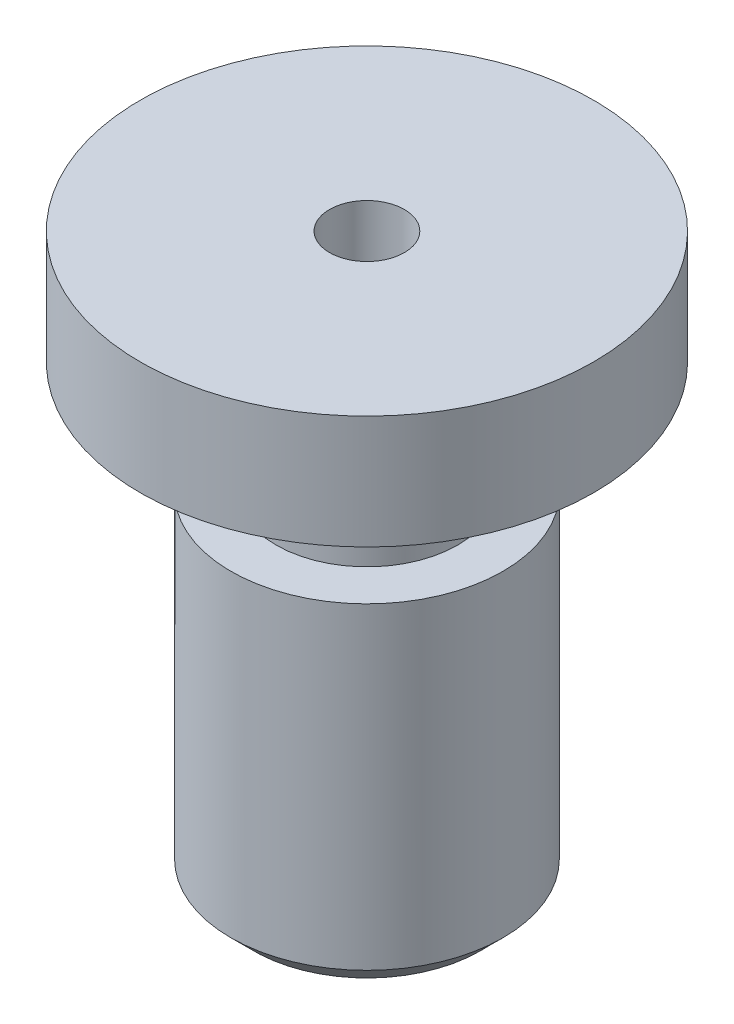
from build123d import *

# Parameters (mm, degrees)
CHAMFER_1_SIZE         = 1
HOLE_WIZARD_M4_1_D     = 3.3
HOLE_WIZARD_M4_1_DEPTH = 10
HOLE_WIZARD_M4_1_TIP   = 0.991420021


with BuildPart() as part:
    # 草图1 → 旋转1 (revolve)
    with BuildSketch(Plane.XY, mode=Mode.PRIVATE) as revolve_1_sk:
        Polygon((0, 0), (-6, 0), (-6, 15), (-4, 15), (-4, 20), (-10, 20), (-10, 25), (0, 25), align=None)
    revolve(revolve_1_sk.sketch.rotate(Axis((0, -198.13008407, 0), (0, 1, 0)), 180), axis=Axis((0, -198.13008407, 0), (0, 1, 0)))

    # 倒角1
    chamfer_1_edges = [part.edges().sort_by_distance(p)[0] for p in [
        (-6, 0, 0),
    ]]
    chamfer(chamfer_1_edges, length=CHAMFER_1_SIZE)

    # M4 螺纹孔1
    with Locations(Plane(origin=(0, 25, 0), x_dir=(1, 0, 0), z_dir=(0, 1, 0))):
        with Locations((0, 0)):
            Hole(HOLE_WIZARD_M4_1_D / 2, depth=HOLE_WIZARD_M4_1_DEPTH)
            with Locations((0, 0, -(HOLE_WIZARD_M4_1_DEPTH + HOLE_WIZARD_M4_1_TIP / 2))):  # 118° drill point
                Cone(0, HOLE_WIZARD_M4_1_D / 2, HOLE_WIZARD_M4_1_TIP, mode=Mode.SUBTRACT)


solid = part.part
